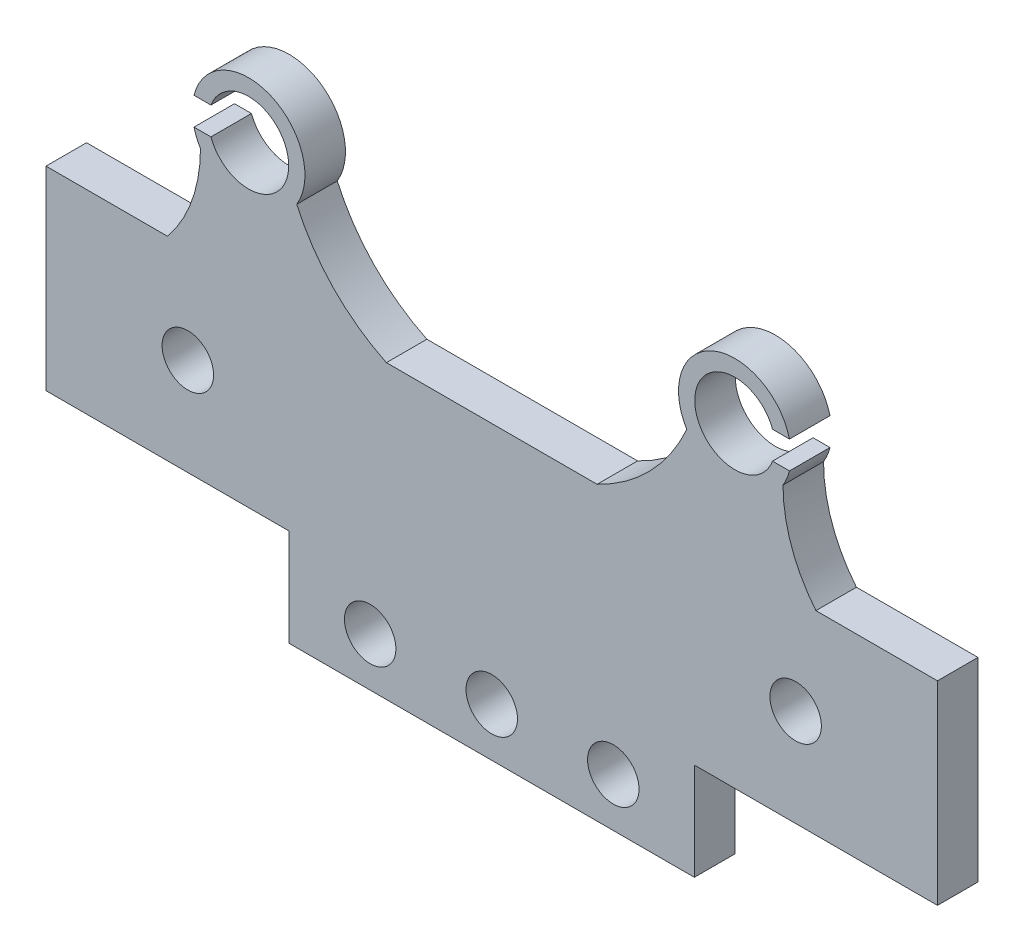
from build123d import *

# Parameters (mm, degrees)
CROQUIS1_R              = 4.95
CROQUIS1_R_2            = 3.175
SALIENTE_EXTRUIR1_DEPTH = 5
CORTAR_EXTRUIR1_DEPTH   = 66.924198895


with BuildPart() as part:
    # Croquis1 → Saliente-Extruir1 (new body)
    with BuildSketch(Plane.XY):
        with BuildLine():
            Line((13, 0), (-13, 0))
            ThreePointArc((-13, 0), (-19.544656296, 4.709966775), (-24.061489507, 11.389377737))
            ThreePointArc((-24.061489507, 11.389377737), (-30, 21.95), (-35.938510493, 11.389377737))
            ThreePointArc((-35.938510493, 11.389377737), (-36.984260452, 5.34343649), (-40, 0))
            Line((-40, 0), (-55, 0))
            Line((-55, 0), (-55, -24))
            Line((-55, -24), (-25, -24))
            Line((-25, -24), (-25, -36))
            Line((-25, -36), (25, -36))
            Line((25, -36), (25, -24))
            Line((25, -24), (55, -24))
            Line((55, -24), (55, 0))
            Line((55, 0), (40, 0))
            ThreePointArc((40, 0), (36.984260452, 5.34343649), (35.938510493, 11.389377737))
            ThreePointArc((35.938510493, 11.389377737), (30, 21.95), (24.061489507, 11.389377737))
            ThreePointArc((24.061489507, 11.389377737), (19.544656296, 4.709966775), (13, 0))
        make_face()
        with Locations((-30, 15)):
            Circle(CROQUIS1_R, mode=Mode.SUBTRACT)
        with Locations((-37.5, -12)):
            Circle(CROQUIS1_R_2, mode=Mode.SUBTRACT)
        with Locations((0, -30)):
            Circle(CROQUIS1_R_2, mode=Mode.SUBTRACT)
        with Locations(Location((30, 15, 0), (0, 0, 180))):
            Circle(CROQUIS1_R, mode=Mode.SUBTRACT)
        with Locations(Location((37.5, -12, 0), (0, 0, 180))):
            Circle(CROQUIS1_R_2, mode=Mode.SUBTRACT)
        with Locations((-15, -30)):
            Circle(CROQUIS1_R_2, mode=Mode.SUBTRACT)
        with Locations(Location((15, -30, 0), (0, 0, 180))):
            Circle(CROQUIS1_R_2, mode=Mode.SUBTRACT)
    extrude(amount=SALIENTE_EXTRUIR1_DEPTH)

    # Croquis2 → Cortar-Extruir1 (cut, through all)
    with BuildSketch(Plane.XY):
        with BuildLine():
            Line((-30, 16.7), (-36.738879729, 16.7))
            ThreePointArc((-36.738879729, 16.7), (-36.95, 15), (-36.738879729, 13.3))
            Line((-36.738879729, 13.3), (-30, 13.3))
            Line((-30, 13.3), (-30, 16.7))
        make_face()
        with BuildLine():
            Line((30, 16.7), (30, 13.3))
            Line((30, 13.3), (36.738879729, 13.3))
            ThreePointArc((36.738879729, 13.3), (36.95, 15), (36.738879729, 16.7))
            Line((36.738879729, 16.7), (30, 16.7))
        make_face()
    extrude(amount=CORTAR_EXTRUIR1_DEPTH, mode=Mode.SUBTRACT)


solid = part.part
